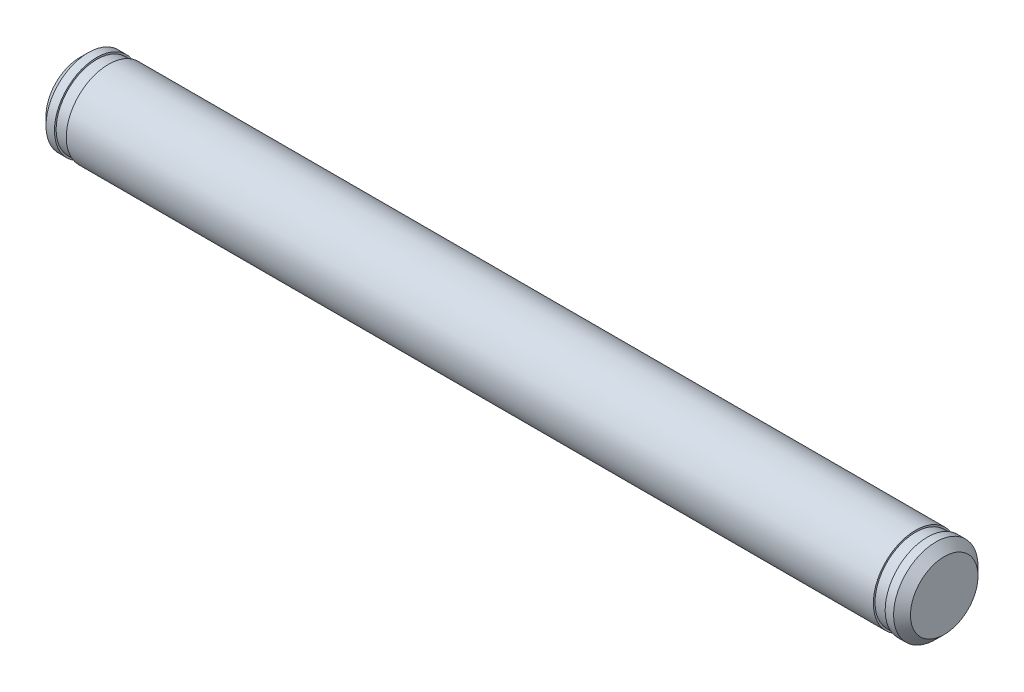
from build123d import *

# Parameters (mm, degrees)
CHAMFER_1_SIZE = 0.5


with BuildPart() as part:
    # 草图1 → 旋转1 (revolve)
    with BuildSketch(Plane.XY):
        Polygon((25.6, 0), (25.6, 2.5), (24.6, 2.5), (24.6, 2.4), (23.9, 2.4), (23.9, 2.5), (-23.9, 2.5), (-23.9, 2.4), (-24.6, 2.4), (-24.6, 2.5), (-25.6, 2.5), (-25.6, 0), align=None)
    revolve(axis=Axis((25.6, 0, 0), (-1, 0, 0)))

    # 倒角1
    chamfer_1_edges = [part.edges().sort_by_distance(p)[0] for p in [
        (-25.6, -2.5, 0),
        (25.6, -2.5, 0),
    ]]
    chamfer(chamfer_1_edges, length=CHAMFER_1_SIZE)


solid = part.part
